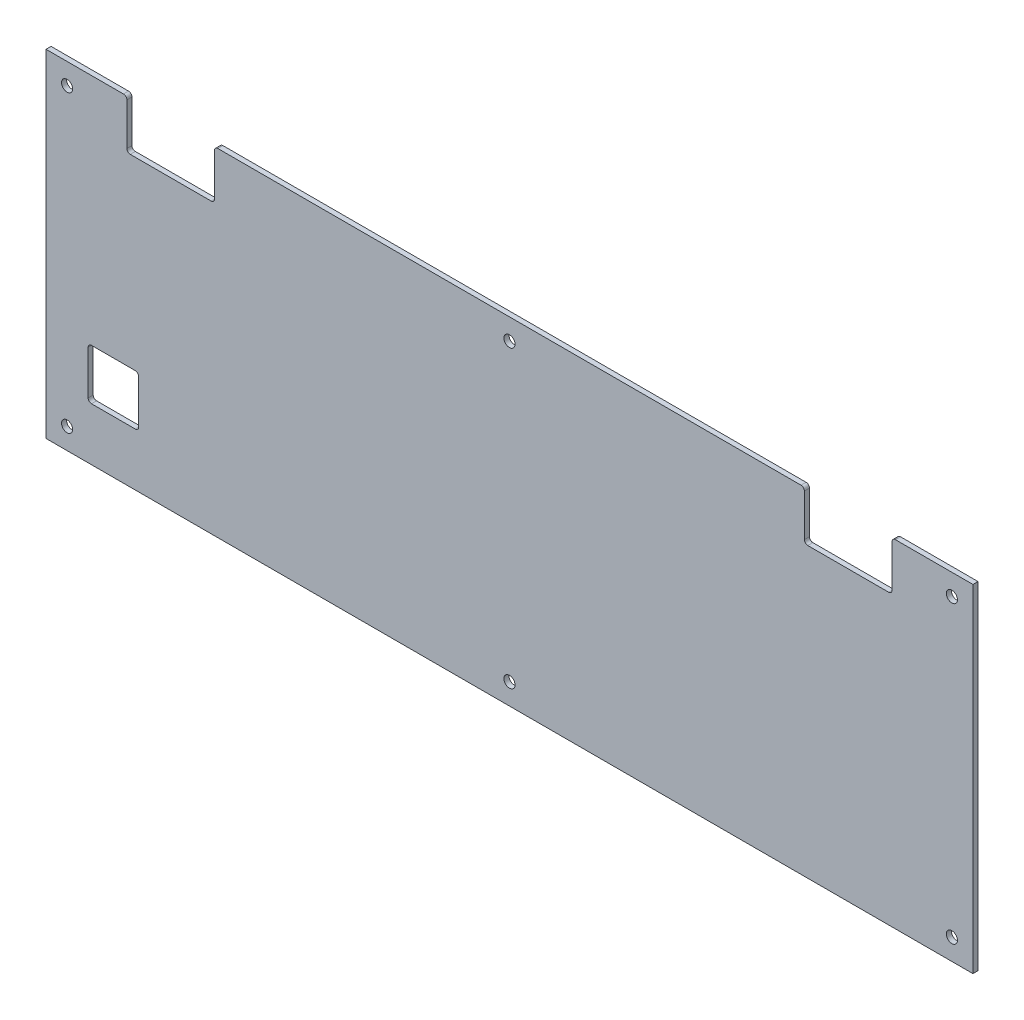
from build123d import *

# Parameters (mm, degrees)
BOSS_EXTRUDE1_DEPTH  = 3
M6_CLEARANCE_HOLE1_D = 6.6
CUT_EXTRUDE1_DEPTH   = 531.358070854


with BuildPart() as part:
    # Sketch1 → Boss-Extrude1 (new body)
    with BuildSketch(Plane.XY):
        with BuildLine():
            Line((-49.354733049, -25), (500.645266951, -25))
            Line((500.645266951, -25), (500.645266951, 175))
            Line((500.645266951, 175), (454.645266951, 175))
            ThreePointArc((454.645266951, 175), (453.231053388, 174.414213562), (452.645266951, 173))
            Line((452.645266951, 173), (452.645266951, 148))
            ThreePointArc((452.645266951, 148), (452.059480513, 146.585786438), (450.645266951, 146))
            Line((450.645266951, 146), (402.645266951, 146))
            ThreePointArc((402.645266951, 146), (401.231053388, 146.585786438), (400.645266951, 148))
            Line((400.645266951, 148), (400.645266951, 173))
            ThreePointArc((400.645266951, 173), (400.059480513, 174.414213562), (398.645266951, 175))
            Line((398.645266951, 175), (52.645266951, 175))
            ThreePointArc((52.645266951, 175), (51.231053388, 174.414213562), (50.645266951, 173))
            Line((50.645266951, 173), (50.645266951, 148))
            ThreePointArc((50.645266951, 148), (50.059480513, 146.585786438), (48.645266951, 146))
            Line((48.645266951, 146), (0.645266951, 146))
            ThreePointArc((0.645266951, 146), (-0.768946612, 146.585786438), (-1.354733049, 148))
            Line((-1.354733049, 148), (-1.354733049, 173))
            ThreePointArc((-1.354733049, 173), (-1.940519487, 174.414213562), (-3.354733049, 175))
            Line((-3.354733049, 175), (-49.354733049, 175))
            Line((-49.354733049, 175), (-49.354733049, -25))
        make_face()
    extrude(amount=BOSS_EXTRUDE1_DEPTH)

    # M6 Clearance Hole1 (through all)
    with Locations(Plane.XY.offset(3)):
        with Locations((225.645266951, -12.5), (225.645266951, 162.5), (488.145266951, -12.5), (488.145266951, 162.5), (-36.854733049, 162.5), (-36.854733049, -12.5)):
            Hole(M6_CLEARANCE_HOLE1_D / 2)

    # Sketch4 → Cut-Extrude1 (cut, through all)
    with BuildSketch(Plane.XY.offset(3)):
        with BuildLine():
            Line((-22.354733049, 6.35), (3.645266951, 6.35))
            ThreePointArc((3.645266951, 6.35), (5.059480513, 6.935786438), (5.645266951, 8.35))
            Line((5.645266951, 8.35), (5.645266951, 34.35))
            ThreePointArc((5.645266951, 34.35), (5.059480513, 35.764213562), (3.645266951, 36.35))
            Line((3.645266951, 36.35), (-22.354733049, 36.35))
            ThreePointArc((-22.354733049, 36.35), (-23.768946612, 35.764213562), (-24.354733049, 34.35))
            Line((-24.354733049, 34.35), (-24.354733049, 8.35))
            ThreePointArc((-24.354733049, 8.35), (-23.768946612, 6.935786438), (-22.354733049, 6.35))
        make_face()
    extrude(amount=-CUT_EXTRUDE1_DEPTH, mode=Mode.SUBTRACT)


solid = part.part
